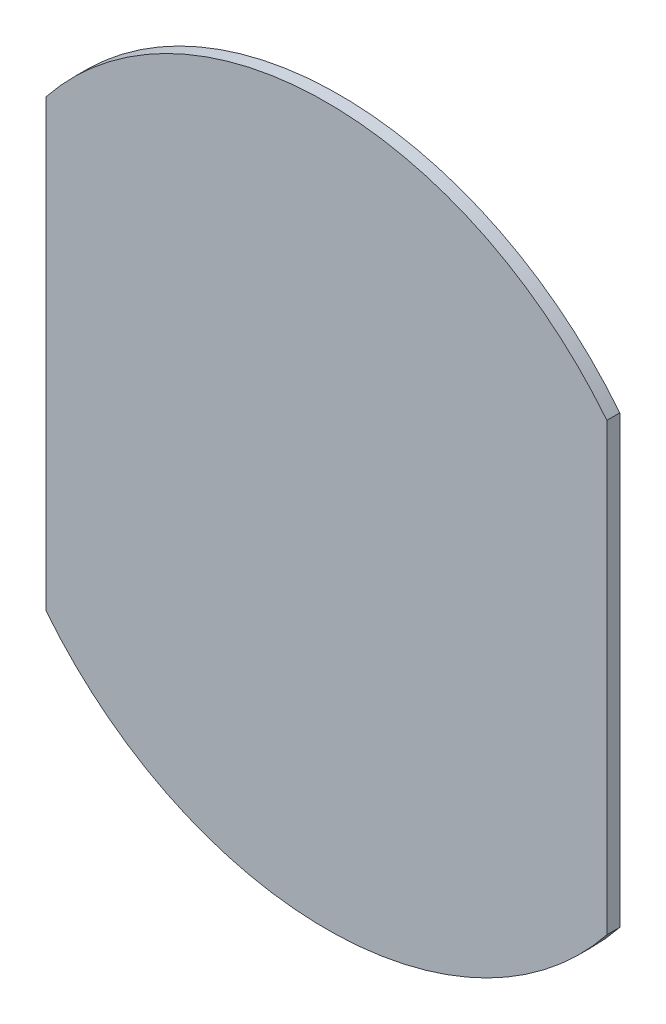
from build123d import *

# Parameters (mm, degrees)
P_IDAT_VYSUNUT_M1_DEPTH  = 1.7
SKICA2_W                 = 11.887522694
SKICA2_H                 = 88.035963051
ODEBRAT_VYSUNUT_M1_DEPTH = 10


with BuildPart() as part:
    # Skica1 → Přidat vysunutím1 (new body)
    with BuildSketch(Plane.XY):
        with BuildLine():
            Line((-44.112356546, 16.65), (-36.912356546, 16.65))
            Line((-36.912356546, 16.65), (-36.912356546, -16.65))
            Line((-36.912356546, -16.65), (-44.112356546, -16.65))
            ThreePointArc((-44.112356546, -16.65), (0, -47.15), (44.112356546, -16.65))
            Line((44.112356546, -16.65), (36.912356546, -16.65))
            Line((36.912356546, -16.65), (36.912356546, 16.65))
            Line((36.912356546, 16.65), (44.112356546, 16.65))
            ThreePointArc((44.112356546, 16.65), (0, 47.15), (-44.112356546, 16.65))
        make_face()
    extrude(amount=P_IDAT_VYSUNUT_M1_DEPTH)

    # Skica2 → Odebrat vysunutím1 (cut)
    with BuildSketch(Plane(origin=(0, 0, 0), x_dir=(-1, 0, 0), z_dir=(0, 0, -1))):
        with Locations((-42.856117893, -1.532659523)):
            Rectangle(SKICA2_W, SKICA2_H)
        with Locations((42.856117893, -1.532659523)):
            Rectangle(SKICA2_W, SKICA2_H)
    extrude(amount=-ODEBRAT_VYSUNUT_M1_DEPTH, mode=Mode.SUBTRACT)


solid = part.part
